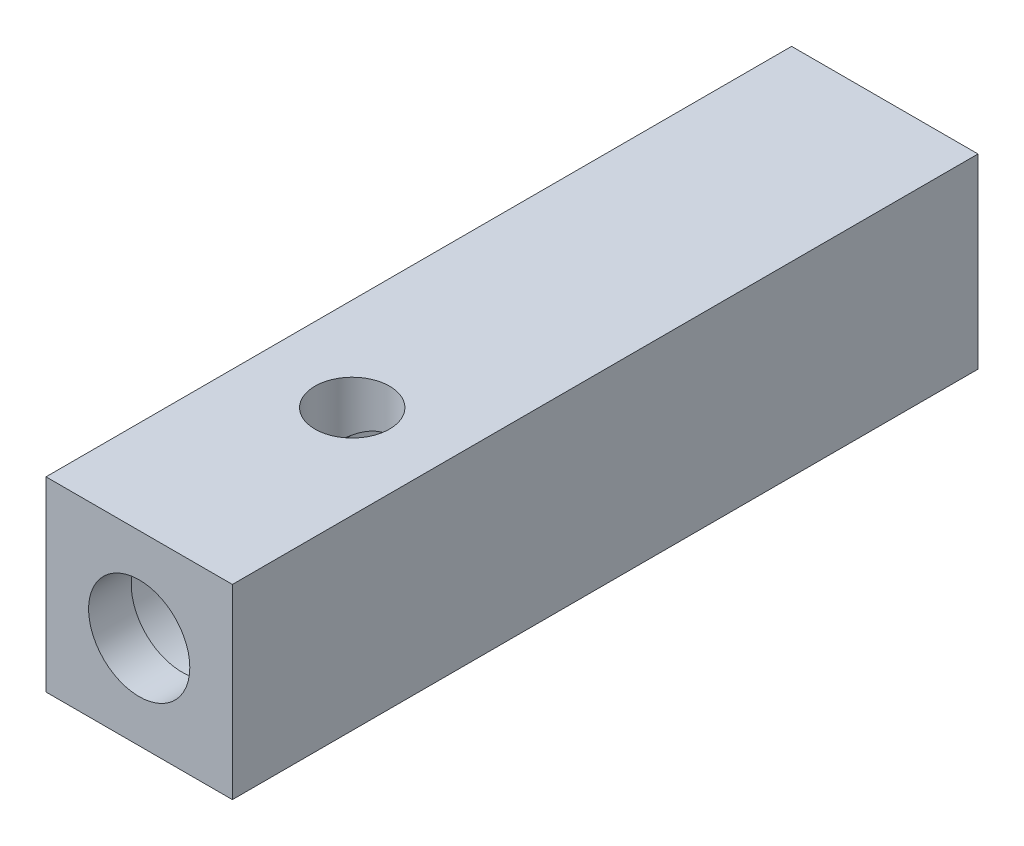
from build123d import *
from build123d.topology import SkipClean

# Parameters (mm, degrees)
BOSS_EXTRUDE1_START = -20
SKETCH1_W           = 17.5
SKETCH1_H           = 17.5
BOSS_EXTRUDE1_DEPTH = 70
SKETCH2_R           = 4.75
CUT_EXTRUDE1_DEPTH  = 150
SKETCH3_R           = 3.5
CUT_EXTRUDE6_DEPTH  = 25
CUT_EXTRUDE9_START  = -4
CUT_EXTRUDE9_DEPTH  = 66
CUT_EXTRUDE13_START = -4
CUT_EXTRUDE13_DEPTH = 5


with BuildPart() as part:
    # Sketch1 → Boss-Extrude1 (new body)
    with BuildSketch(Plane.XY.offset(BOSS_EXTRUDE1_START)):
        with Locations((-0.75, -0.85483871)):
            Rectangle(SKETCH1_W, SKETCH1_H)
    extrude(amount=BOSS_EXTRUDE1_DEPTH)

    # Sketch2 → Cut-Extrude1 (cut)
    with BuildSketch(Plane(origin=(0, 0, -20), x_dir=(-1, 0, 0), z_dir=(0, 0, -1))):
        with Locations((0.75, -0.85483871)):
            Circle(SKETCH2_R)
    extrude(amount=-CUT_EXTRUDE1_DEPTH, mode=Mode.SUBTRACT)

    # Sketch3 → Cut-Extrude6 (cut)
    with BuildSketch(Plane(origin=(0, 7.89516129, 0), x_dir=(1, 0, 0), z_dir=(0, 1, 0))):
        with Locations(Location((-0.75, -30, 0), (0, 0, 270))):
            Circle(SKETCH3_R)
    extrude(amount=-CUT_EXTRUDE6_DEPTH, mode=Mode.SUBTRACT)

    # Sketch6 → Cut-Extrude9 (cut)
    with BuildSketch(Plane.XY.offset(50).offset(CUT_EXTRUDE9_START)):
        with BuildLine():
            Line((-7.288348415, 1.64516129), (5.788348415, 1.64516129))
            ThreePointArc((5.788348415, 1.64516129), (6.25, -0.85483871), (5.788348415, -3.35483871))
            Line((5.788348415, -3.35483871), (-7.288348415, -3.35483871))
            ThreePointArc((-7.288348415, -3.35483871), (-7.75, -0.85483871), (-7.288348415, 1.64516129))
        make_face()
    extrude(amount=-CUT_EXTRUDE9_DEPTH, mode=Mode.SUBTRACT)

    # Sketch4 → Cut-Extrude13 (cut)
    with SkipClean():  # the faces are left unmerged after this step: merging them gives an invalid solid
        with BuildSketch(Plane.XY.offset(50).offset(CUT_EXTRUDE13_START)):
            with BuildLine():
                ThreePointArc((1.849543844, -4.830372863), (1.468272605, -5.05504902), (1.067746304, -5.243266489))
                Line((1.067746304, -5.243266489), (1.928784027, -7.321995437))
                ThreePointArc((1.928784027, -7.321995437), (2.519033312, -7.044622325), (3.080906718, -6.71352062))
                Line((3.080906718, -6.71352062), (1.849543844, -4.830372863))
            make_face()
            with BuildLine():
                ThreePointArc((1.067746304, -5.243266489), (-3.388958607, -4.804319368), (-5.5, -0.85483871))
                Line((-5.5, -0.85483871), (-7.75, -0.85483871))
                ThreePointArc((-7.75, -0.85483871), (-4.638991631, -6.675125996), (1.928784027, -7.321995437))
                Line((1.928784027, -7.321995437), (1.067746304, -5.243266489))
            make_face()
            with BuildLine():
                ThreePointArc((-3.349543844, 3.120695443), (-2.968272605, 3.345371601), (-2.567746304, 3.53358907))
                Line((-2.567746304, 3.53358907), (-3.428784027, 5.612318018))
                ThreePointArc((-3.428784027, 5.612318018), (-4.019033312, 5.334944906), (-4.580906718, 5.0038432))
                Line((-4.580906718, 5.0038432), (-3.349543844, 3.120695443))
            make_face()
            with BuildLine():
                ThreePointArc((-2.567746304, 3.53358907), (1.888958607, 3.094641949), (4, -0.85483871))
                Line((4, -0.85483871), (6.25, -0.85483871))
                ThreePointArc((6.25, -0.85483871), (3.138991631, 4.965448576), (-3.428784027, 5.612318018))
                Line((-3.428784027, 5.612318018), (-2.567746304, 3.53358907))
            make_face()
        extrude(amount=-CUT_EXTRUDE13_DEPTH, mode=Mode.SUBTRACT)


solid = part.part
